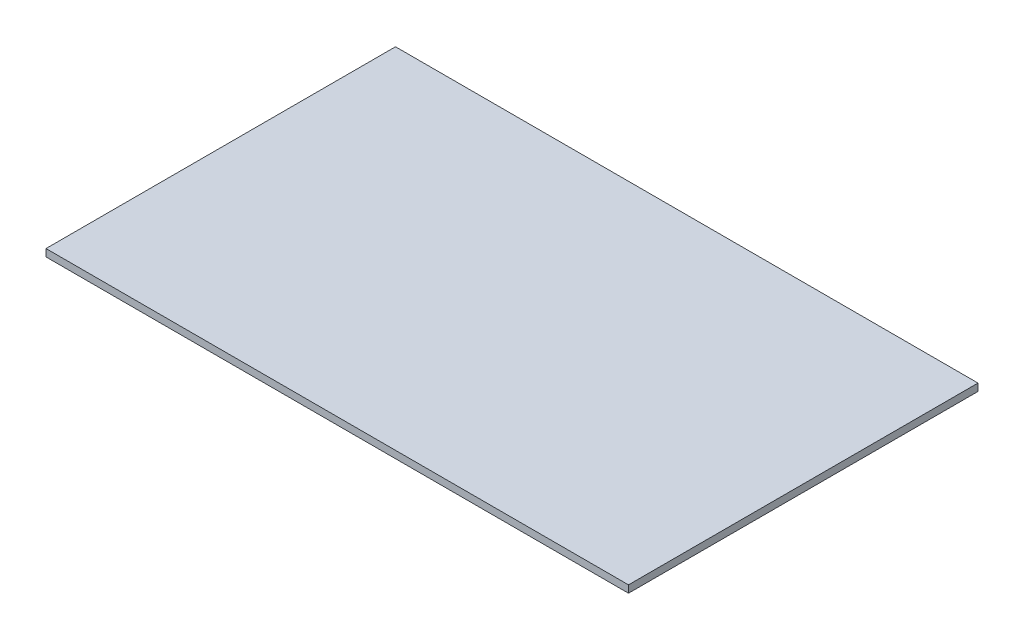
from build123d import *

# Parameters (mm, degrees)
SKETCH1_W           = 800
SKETCH1_H           = 480
BOSS_EXTRUDE1_DEPTH = 5


with BuildPart() as part:
    # Sketch1 → Boss-Extrude1 (new, symmetric)
    with BuildSketch(Plane(origin=(0, 0, 0), x_dir=(1, 0, 0), z_dir=(0, 1, 0))):
        Rectangle(SKETCH1_W, SKETCH1_H)
    extrude(amount=BOSS_EXTRUDE1_DEPTH, both=True)


solid = part.part
